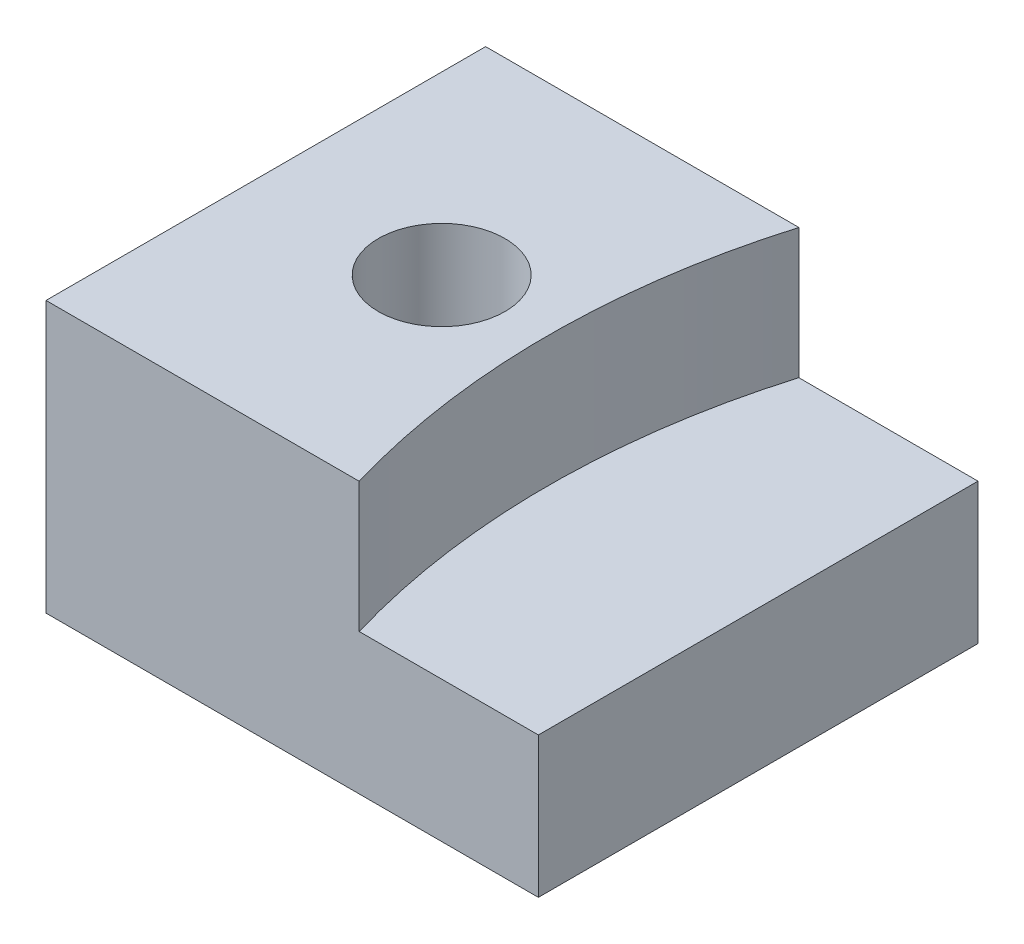
from build123d import *

# Parameters (mm, degrees)
SKETCH3_W           = 7
SKETCH3_H           = 6.25
SKETCH3_R           = 0.9
BOSS_EXTRUDE1_DEPTH = 2
SKETCH6_R           = 0.9
BOSS_EXTRUDE3_DEPTH = 1.85


with BuildPart() as part:
    # Sketch3 → Boss-Extrude1 (new body)
    with BuildSketch(Plane(origin=(0, 0, 0), x_dir=(1, 0, 0), z_dir=(0, 1, 0))):
        with Locations((1, 0)):
            Rectangle(SKETCH3_W, SKETCH3_H)
        with Locations(Location((0, 0, 0), (0, 0, 270))):
            Circle(SKETCH3_R, mode=Mode.SUBTRACT)
    extrude(amount=BOSS_EXTRUDE1_DEPTH)

    # Sketch6 → Boss-Extrude3 (add)
    with BuildSketch(Plane(origin=(0, 2, 0), x_dir=(1, 0, 0), z_dir=(0, 1, 0))):
        with BuildLine():
            Line((-2.5, 3.125), (-2.5, -3.125))
            Line((-2.5, -3.125), (1.953229167, -3.125))
            ThreePointArc((1.953229167, -3.125), (1.5, 0), (1.953229167, 3.125))
            Line((1.953229167, 3.125), (-2.5, 3.125))
        make_face()
        with Locations(Location((0, 0, 0), (0, 0, 270))):
            Circle(SKETCH6_R, mode=Mode.SUBTRACT)
    extrude(amount=BOSS_EXTRUDE3_DEPTH)


solid = part.part
